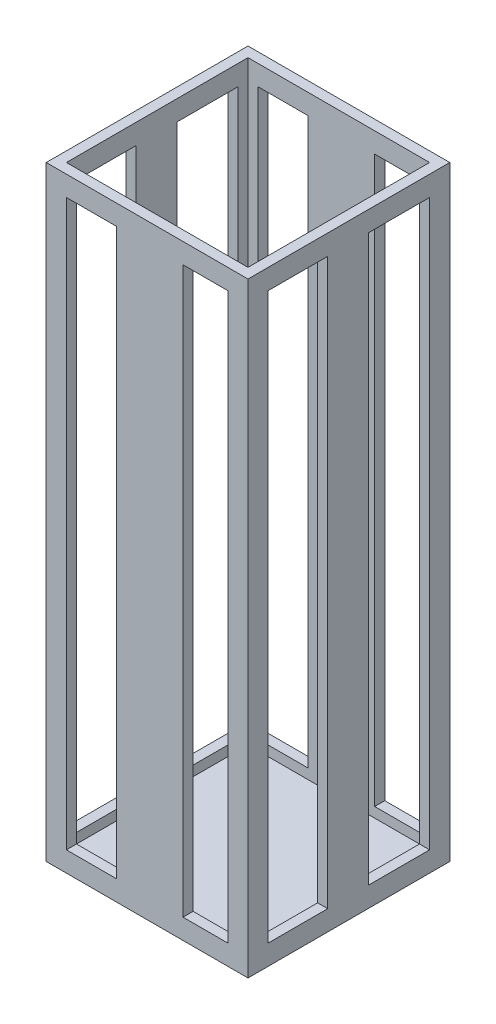
from build123d import *

# Parameters (mm, degrees)
SKETCH1_W               = 100
SKETCH1_H               = 100
BOSS_EXTRUDE1_DEPTH     = 300
SHELL1_T                = -5
SKETCH5_W               = 29.520338389
SKETCH5_H               = 280
SKETCH5_W_2             = 30.177604706
CUT_EXTRUDE3_DEPTH      = 332.662479036
CUT_EXTRUDE4_DEPTH      = 332.662479036
CUT_EXTRUDE4_DEPTH_BACK = 332.662479036
SKETCH7_W               = 22.211506019
SKETCH7_H               = 280
SKETCH7_W_2             = 24.857728264
SKETCH8_R               = 2.210472055
BOSS_EXTRUDE2_DEPTH     = 1
BOSS_EXTRUDE3_DEPTH     = 2
SKETCH10_R              = 1
BOSS_EXTRUDE4_DEPTH     = 2


with BuildPart() as part:
    # Sketch1 → Boss-Extrude1 (new body)
    with BuildSketch(Plane(origin=(0, 0, 0), x_dir=(1, 0, 0), z_dir=(0, 1, 0))):
        with Locations((50, 50)):
            Rectangle(SKETCH1_W, SKETCH1_H)
    extrude(amount=BOSS_EXTRUDE1_DEPTH)

    # Shell1
    shell1_openings = [part.faces().sort_by_distance(p)[0] for p in [
        (50, 300, -50),
    ]]
    offset(amount=SHELL1_T, openings=shell1_openings, kind=Kind.INTERSECTION)

    # Sketch5 → Cut-Extrude3 (cut, through all)
    with BuildSketch(Plane(origin=(100, 0, 0), x_dir=(0, 0, -1), z_dir=(1, 0, 0))):
        with Locations((24.760169195, 150)):
            Rectangle(SKETCH5_W, SKETCH5_H)
        with Locations((74.911197647, 150)):
            Rectangle(SKETCH5_W_2, SKETCH5_H)
    extrude(amount=-CUT_EXTRUDE3_DEPTH, mode=Mode.SUBTRACT)

    # Sketch7 → Cut-Extrude4 (cut, two sides: drawn at the far end of the back side and taken through both)
    with BuildSketch(Plane(origin=(0, 0, -100), x_dir=(-1, 0, 0), z_dir=(0, 0, -1)).offset(-CUT_EXTRUDE4_DEPTH_BACK)):
        with Locations((-78.89424699, 150)):
            Rectangle(SKETCH7_W, SKETCH7_H)
        with Locations((-22.428864132, 150)):
            Rectangle(SKETCH7_W_2, SKETCH7_H)
    extrude(amount=CUT_EXTRUDE4_DEPTH + CUT_EXTRUDE4_DEPTH_BACK, mode=Mode.SUBTRACT)

    # Sketch8 → Boss-Extrude2 (add)
    with BuildSketch(Plane(origin=(0, 0, -5), x_dir=(-1, 0, 0), z_dir=(0, 0, -1))):
        with Locations((-52.421904505, 126.432189468)):
            Circle(SKETCH8_R)
    extrude(amount=BOSS_EXTRUDE2_DEPTH)

    # Sketch9 → Boss-Extrude3 (add)
    with BuildSketch(Plane(origin=(0, 5, 0), x_dir=(1, 0, 0), z_dir=(0, 1, 0))):
        with BuildLine():
            ThreePointArc((51, 50), (50, 51), (49, 50))
            Line((49, 50), (51, 50))
        make_face()
        with BuildLine():
            Line((51, 50), (49, 50))
            ThreePointArc((49, 50), (50, 49), (51, 50))
        make_face()
    extrude(amount=BOSS_EXTRUDE3_DEPTH)

    # Sketch10 → Boss-Extrude4 (add)
    with BuildSketch(Plane.ZY.offset(-95)):
        with Locations((-50.457978823, 101.351671268)):
            Circle(SKETCH10_R)
    extrude(amount=BOSS_EXTRUDE4_DEPTH)


solid = part.part
